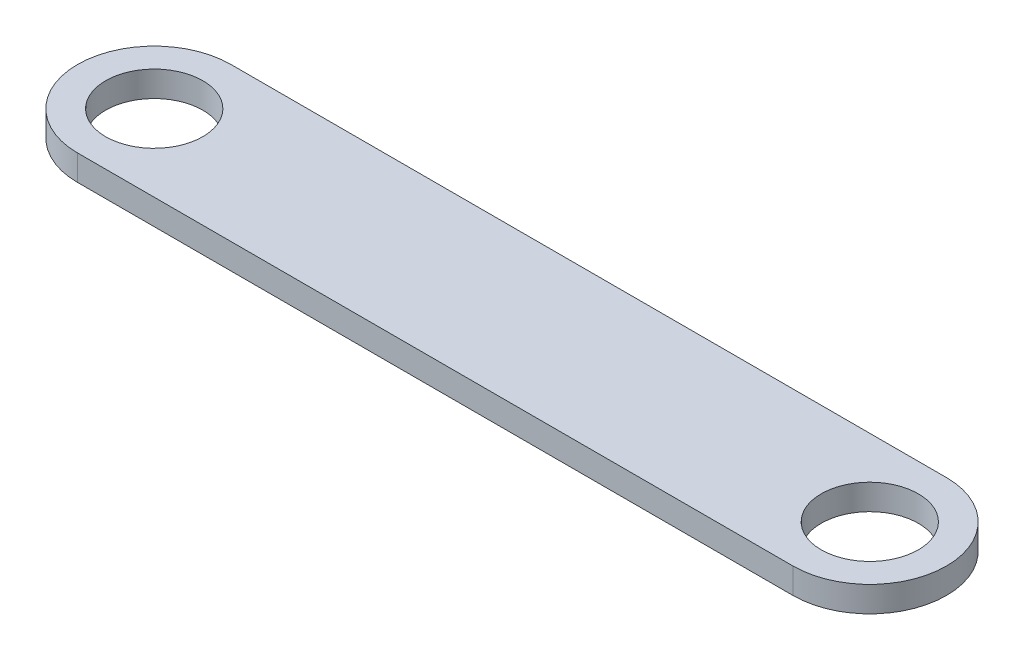
from build123d import *

# Parameters (mm, degrees)
SALIENTE_EXTRUIR1_DEPTH = 2.5
CROQUIS2_R              = 4.75
CORTAR_EXTRUIR1_DEPTH   = 44.229041164


with BuildPart() as part:
    # Croquis1 → Saliente-Extruir1 (new body)
    with BuildSketch(Plane(origin=(0, 0, 0), x_dir=(1, 0, 0), z_dir=(0, 1, 0))):
        with BuildLine():
            Line((-35, 7.5), (35, 7.5))
            ThreePointArc((35, 7.5), (42.5, 0), (35, -7.5))
            Line((35, -7.5), (-35, -7.5))
            ThreePointArc((-35, -7.5), (-42.5, 0), (-35, 7.5))
        make_face()
    extrude(amount=SALIENTE_EXTRUIR1_DEPTH)

    # Croquis2 → Cortar-Extruir1 (cut, through all)
    with BuildSketch(Plane(origin=(0, 2.5, 0), x_dir=(1, 0, 0), z_dir=(0, 1, 0))):
        with Locations(Location((-35, 0, 0), (0, 0, 270))):
            Circle(CROQUIS2_R)
        with Locations(Location((35, 0, 0), (0, 0, 270))):
            Circle(CROQUIS2_R)
    extrude(amount=-CORTAR_EXTRUIR1_DEPTH, mode=Mode.SUBTRACT)


solid = part.part
